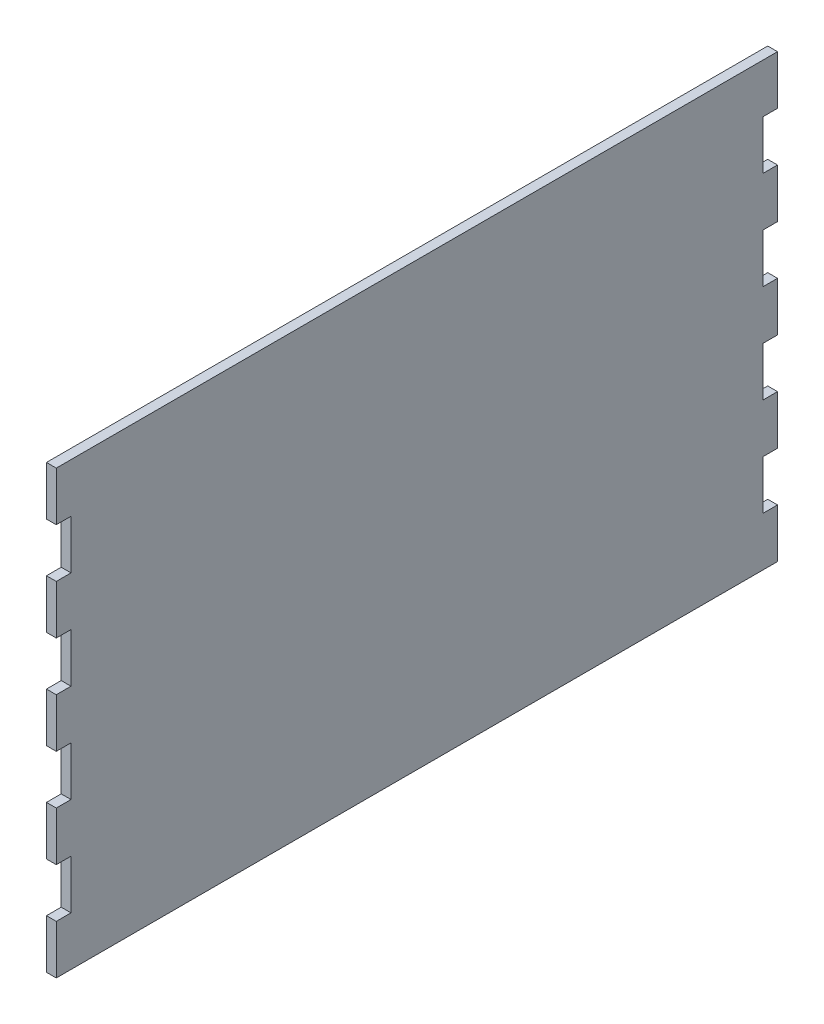
from build123d import *

# Parameters (mm, degrees)
BOSS_EXTRUDE1_DEPTH = 4


with BuildPart() as part:
    # Sketch1 → Boss-Extrude1 (new body)
    with BuildSketch(Plane(origin=(0, 0, 0), x_dir=(0, 0, -1), z_dir=(1, 0, 0))):
        Polygon((-294, 71.849422728), (-294, 51.849422728), (-300, 51.849422728), (-300, 31.849422728), (-294, 31.849422728), (-294, 11.849422728), (-300, 11.849422728), (-300, -8.150577272), (-294, -8.150577272), (-294, -28.150577272), (-300, -28.150577272), (-300, -48.150577272), (-294, -48.150577272), (-294, -68.150577272), (-300, -68.150577272), (-300, -88.150577272), (-6, -88.150577272), (-6, -68.150577272), (-12, -68.150577272), (-12, -48.150577272), (-6, -48.150577272), (-6, -28.150577272), (-12, -28.150577272), (-12, -8.150577272), (-6, -8.150577272), (-6, 11.849422728), (-12, 11.849422728), (-12, 31.849422728), (-6, 31.849422728), (-6, 51.849422728), (-12, 51.849422728), (-12, 71.849422728), (-6, 71.849422728), (-6, 91.849422728), (-300, 91.849422728), (-300, 71.849422728), align=None)
    extrude(amount=BOSS_EXTRUDE1_DEPTH)


solid = part.part
